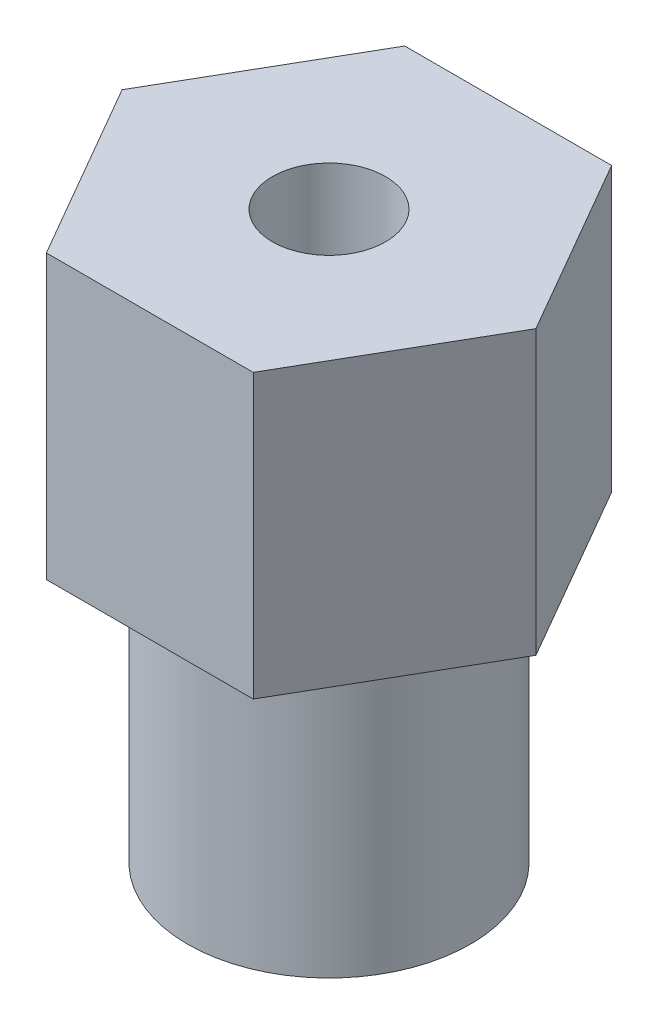
from build123d import *

# Parameters (mm, degrees)
SZKIC1_R                    = 7.5
SZKIC1_R_2                  = 3
DODANIE_WYCI_GNI_CIE1_DEPTH = 15
DODANIE_WYCI_GNI_CIE2_START = -15
SZKIC1_3_R                  = 7.5
SZKIC1_3_R_2                = 3
DODANIE_WYCI_GNI_CIE2_DEPTH = 15


with BuildPart() as part:
    # Szkic1 → Dodanie-wyciągnięcie1 (new body)
    # profile 1 of 2: a face of its own
    with BuildSketch(Plane(origin=(0, 0, 0), x_dir=(1, 0, 0), z_dir=(0, 1, 0))):
        Polygon((-5.484827557, -9.5), (5.484827557, -9.5), (10.969655115, 0), (5.484827557, 9.5), (-5.484827557, 9.5), (-10.969655115, 0), align=None)
        Circle(SZKIC1_R, mode=Mode.SUBTRACT)
    # profile 2 of 2: a face of its own
    with BuildSketch(Plane(origin=(0, 0, 0), x_dir=(1, 0, 0), z_dir=(0, 1, 0))):
        Circle(SZKIC1_R)
        with Locations(Location((0, 0, 0), (0, 0, 270))):
            Circle(SZKIC1_R_2, mode=Mode.SUBTRACT)
    extrude(amount=DODANIE_WYCI_GNI_CIE1_DEPTH)

    # Szkic1<3> → Dodanie-wyciągnięcie2 (add)
    with BuildSketch(Plane(origin=(0, 0, 0), x_dir=(1, 0, 0), z_dir=(0, 1, 0)).offset(DODANIE_WYCI_GNI_CIE2_START)):
        with Locations(Location((0, 0, 0), (0, 0, 270))):
            Circle(SZKIC1_3_R)
        with Locations(Location((0, 0, 0), (0, 0, 270))):
            Circle(SZKIC1_3_R_2, mode=Mode.SUBTRACT)
    extrude(amount=DODANIE_WYCI_GNI_CIE2_DEPTH)


solid = part.part
